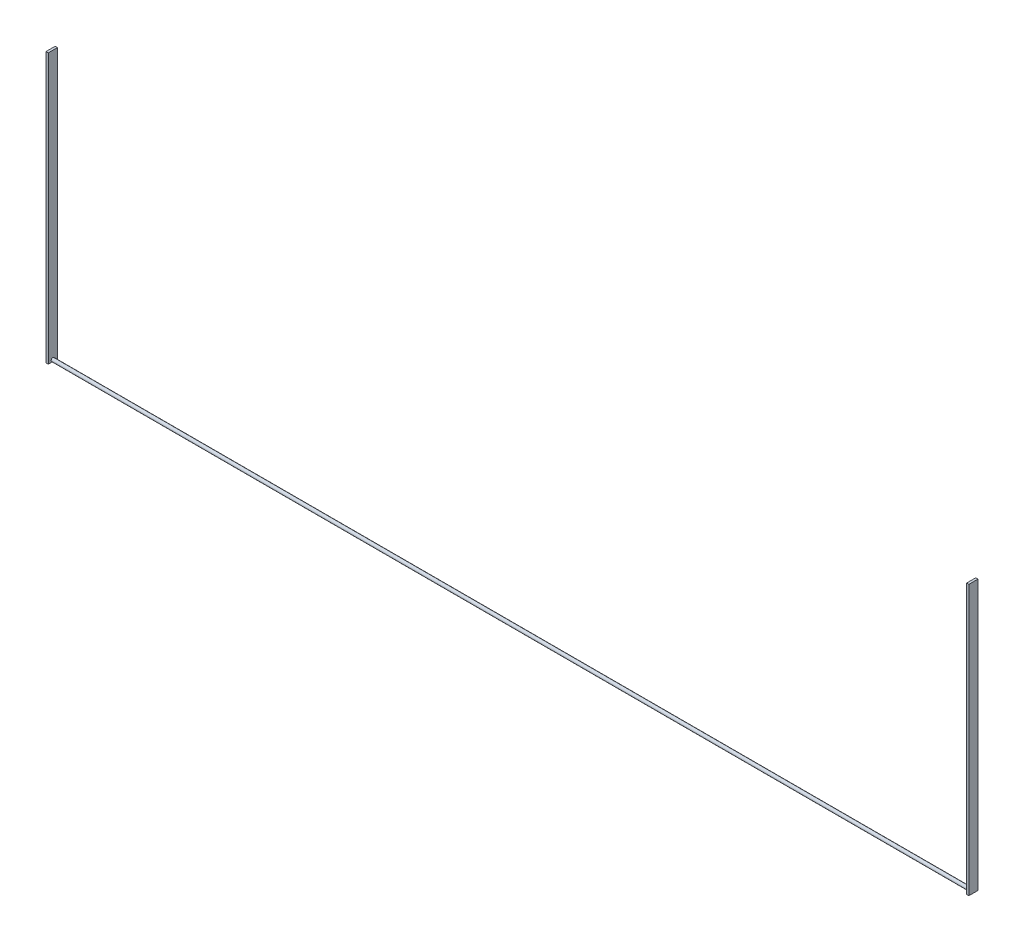
from build123d import *

# Parameters (mm, degrees)
CROQUIS1_W                = 6.35
CROQUIS1_H                = 750
SALIENTE_EXTRUIR1_DEPTH   = 25.4
SALIENTE_EXTRUIR1_2_DEPTH = 25.4
CROQUIS2_R                = 4.7625
SALIENTE_EXTRUIR2_DEPTH   = 2554


with BuildPart() as part:
    # Croquis1 → Saliente-Extruir1 (new body)
    with BuildSketch(Plane.XY):
        with Locations((3.175, 375)):
            Rectangle(CROQUIS1_W, CROQUIS1_H)
    extrude(amount=SALIENTE_EXTRUIR1_DEPTH)



with BuildPart() as body_2:
    # Croquis1 → Saliente-Extruir1 2 (new body)
    with BuildSketch(Plane.XY):
        with Locations((2563.525, 375)):
            Rectangle(CROQUIS1_W, CROQUIS1_H)
    extrude(amount=SALIENTE_EXTRUIR1_2_DEPTH)


with BuildPart() as part_1:
    add(part.part)

    add(body_2.part)  # Saliente-Extruir2 merges body 2
    # Croquis2 → Saliente-Extruir2 (add)
    with BuildSketch(Plane(origin=(6.35, 0, 0), x_dir=(0, 0, -1), z_dir=(1, 0, 0))):
        with Locations(Location((-12.7, 5, 0), (0, 0, 270))):
            Circle(CROQUIS2_R)
    extrude(amount=SALIENTE_EXTRUIR2_DEPTH)


solid = part_1.part
